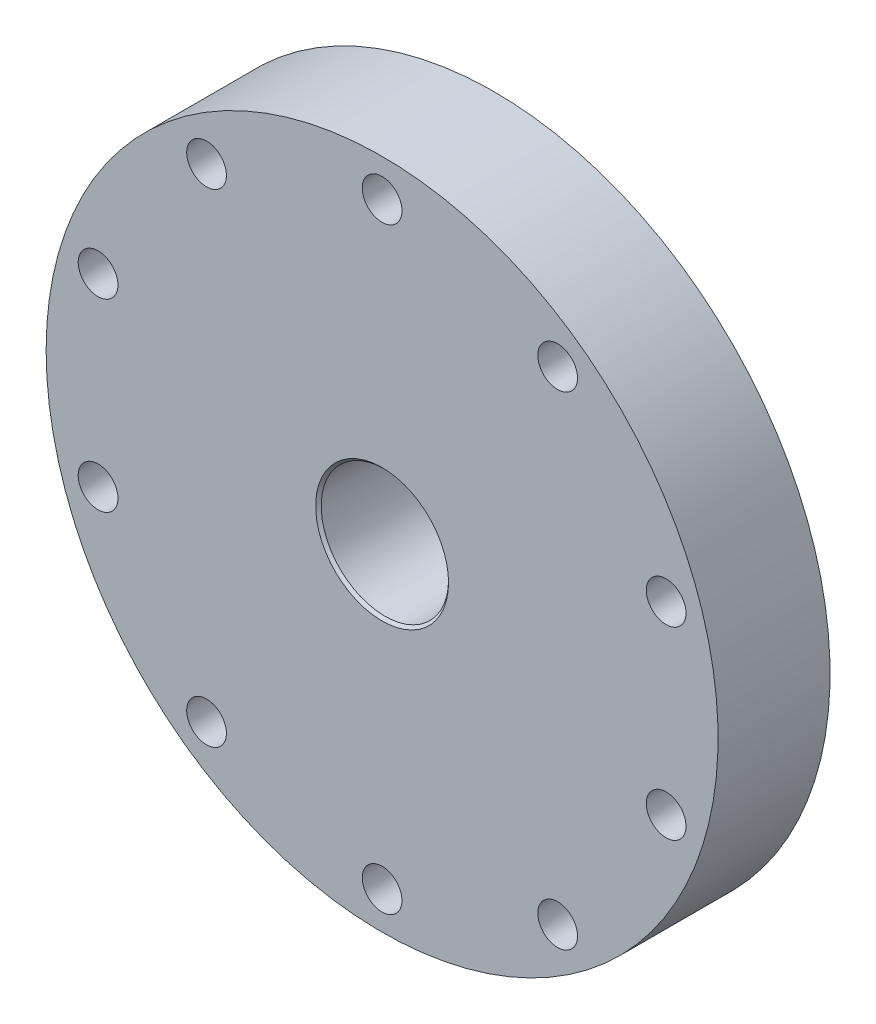
from build123d import *

# Parameters (mm, degrees)
SKETCH1_R                   = 57.15
BOSS_EXTRUDE1_DEPTH         = 19.05
F_1_4_CLEARANCE_HOLE1_D     = 6.7564
F_1_4_CLEARANCE_HOLE1_DEPTH = 57.15
F_1_4_CLEARANCE_HOLE1_TIP   = 2.029827343
SKETCH9_R                   = 44.45
PIPE_ALIGNMENTSEAL_DEPTH    = 2.38125


with BuildPart() as part:
    # Sketch1 → Boss-Extrude1 (new body)
    with BuildSketch(Plane.XY):
        with Locations(Location((0, 0, 0), (0, 0, 180))):
            Circle(SKETCH1_R)
    extrude(amount=BOSS_EXTRUDE1_DEPTH)

    # 1/4 Clearance Hole1
    with Locations(Plane.XY.offset(19.05)):
        with Locations((0, 50.8), (29.859490816, 41.098063314), (48.313671028, 15.698063314), (48.313671028, -15.698063314), (29.859490816, -41.098063314), (0, -50.8), (-29.859490816, -41.098063314), (-48.313671028, -15.698063314), (-48.313671028, 15.698063314), (-29.859490816, 41.098063314)):
            Hole(F_1_4_CLEARANCE_HOLE1_D / 2, depth=F_1_4_CLEARANCE_HOLE1_DEPTH)
            with Locations((0, 0, -(F_1_4_CLEARANCE_HOLE1_DEPTH + F_1_4_CLEARANCE_HOLE1_TIP / 2))):  # 118° drill point
                Cone(0, F_1_4_CLEARANCE_HOLE1_D / 2, F_1_4_CLEARANCE_HOLE1_TIP, mode=Mode.SUBTRACT)

    # Sketch9 → Pipe AlignmentSeal (add)
    with BuildSketch(Plane(origin=(0, 0, 0), x_dir=(-1, 0, 0), z_dir=(0, 0, -1))):
        with Locations(Location((0, 0, 0), (0, 0, 180))):
            Circle(SKETCH9_R)
    extrude(amount=PIPE_ALIGNMENTSEAL_DEPTH)

    # Sketch14 → 1/2 NPT Tapped Hole6 (revolve, cut)
    with BuildSketch(Plane(origin=(0, 0, 19.05), x_dir=(0, -1, 0), z_dir=(1, 0, 0))):
        Polygon((0, 0), (0, 21.43125), (9.5631, 21.43125), (8.9281, 20.79625), (8.9281, 19.05), (10.275764385, 19.05), (10.8320459, 0.4709541), (11.303, 0), align=None)
    revolve(axis=Axis((0, 0, 25.4), (0, 0, -1)), mode=Mode.SUBTRACT)


solid = part.part
